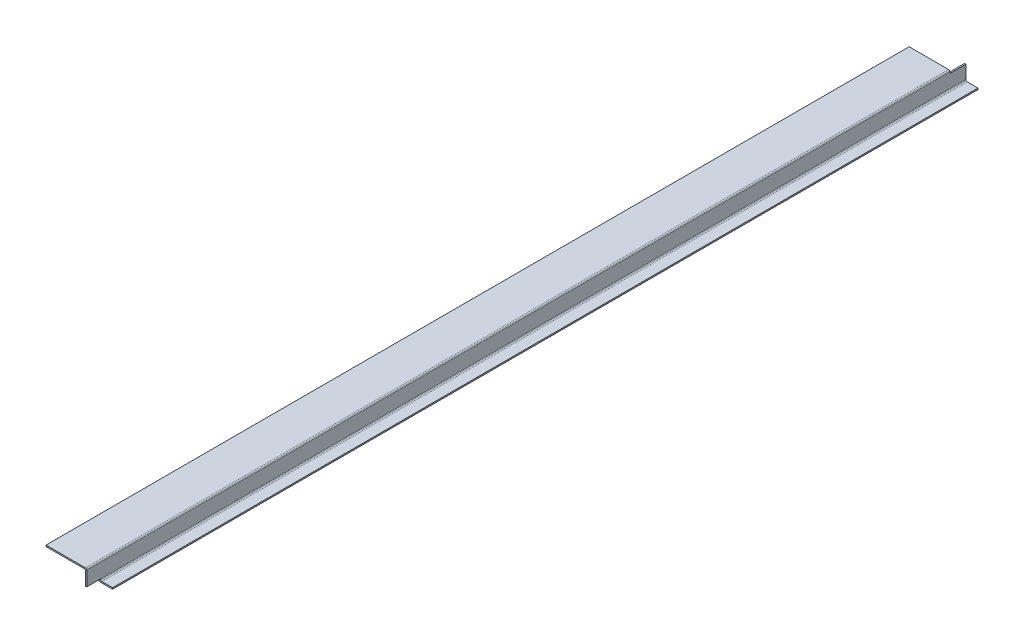
from build123d import *

# Parameters (mm, degrees)
BOSS_EXTRUDE1_DEPTH = 1940
FILLET1_R           = 3
SKETCH2_W           = 90
SKETCH2_H           = 35
CUT_EXTRUDE1_DEPTH  = 6
SKETCH3_W           = 30
SKETCH3_H           = 30
CUT_EXTRUDE2_DEPTH  = 6


with BuildPart() as part:
    # Sketch1 → Boss-Extrude1 (new body)
    with BuildSketch(Plane.XY):
        Polygon((0, 0), (87, 0), (87, -38), (117, -38), (117, -35), (90, -35), (90, 3), (0, 3), align=None)
    extrude(amount=BOSS_EXTRUDE1_DEPTH)

    # Fillet1
    fillet1_edges = [part.edges().sort_by_distance(p)[0] for p in [
        (90, 3, 970),
        (90, -35, 970),
        (87, -38, 970),
        (87, 0, 970),
    ]]
    fillet(fillet1_edges, radius=FILLET1_R)

    # Sketch2 → Cut-Extrude1 (cut)
    with BuildSketch(Plane(origin=(0, 3, 0), x_dir=(1, 0, 0), z_dir=(0, 1, 0))):
        with Locations((45, -17.5)):
            Rectangle(SKETCH2_W, SKETCH2_H)
    extrude(amount=-CUT_EXTRUDE1_DEPTH, mode=Mode.SUBTRACT)

    # Sketch3 → Cut-Extrude2 (cut)
    with BuildSketch(Plane.XZ.offset(38)):
        with Locations((102, 1925)):
            Rectangle(SKETCH3_W, SKETCH3_H)
    extrude(amount=-CUT_EXTRUDE2_DEPTH, mode=Mode.SUBTRACT)


solid = part.part
